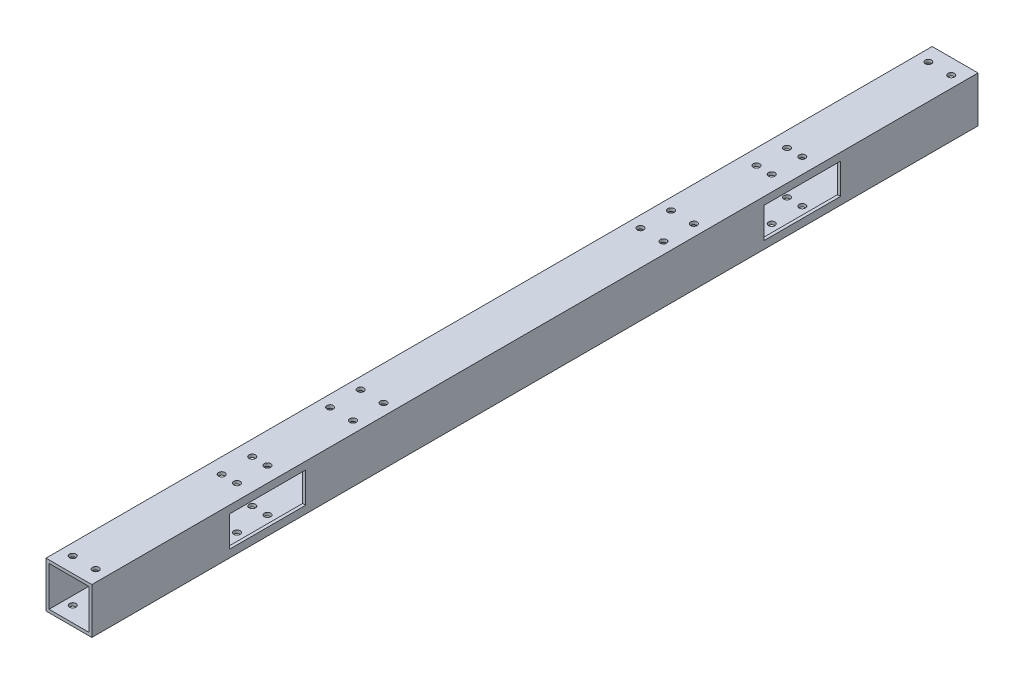
from build123d import *

# Parameters (mm, degrees)
SKETCH_1_W          = 30
SKETCH_1_H          = 30
SKETCH_1_W_2        = 26
SKETCH_1_H_2        = 26
EXTRUDE_1_DEPTH     = 580
SKETCH_2_W          = 50
SKETCH_2_H          = 20
CUT_EXTRUDE_1_DEPTH = 581.969018107
SKETCH_3_R          = 2.1
CUT_EXTRUDE_2_DEPTH = 581.969018107
SKETCH_4_R          = 2.1
CUT_EXTRUDE_3_DEPTH = 581.969018107
SKETCH_7_R          = 2.1
CUT_EXTRUDE_4_DEPTH = 581.969018107


with BuildPart() as part:
    # 草图1 → 凸台-拉伸1 (new body)
    with BuildSketch(Plane.XY):
        Rectangle(SKETCH_1_W, SKETCH_1_H)
        Rectangle(SKETCH_1_W_2, SKETCH_1_H_2, mode=Mode.SUBTRACT)
    extrude(amount=EXTRUDE_1_DEPTH)

    # 草图2 → 切除-拉伸1 (cut, through all)
    with BuildSketch(Plane.ZY.offset(15)):
        with Locations((115, 0)):
            Rectangle(SKETCH_2_W, SKETCH_2_H)
        with Locations((465, 0)):
            Rectangle(SKETCH_2_W, SKETCH_2_H)
    extrude(amount=-CUT_EXTRUDE_1_DEPTH, mode=Mode.SUBTRACT)

    # 草图3 → 切除-拉伸2 (cut, through all)
    with BuildSketch(Plane(origin=(0, 15, 0), x_dir=(1, 0, 0), z_dir=(0, 1, 0))):
        with Locations(Location((7.5, -10, 0), (0, 0, 270))):
            Circle(SKETCH_3_R)
        with Locations(Location((-7.5, -10, 0), (0, 0, 270))):
            Circle(SKETCH_3_R)
        with Locations(Location((-7.5, -570, 0), (0, 0, 270))):
            Circle(SKETCH_3_R)
        with Locations(Location((7.5, -570, 0), (0, 0, 270))):
            Circle(SKETCH_3_R)
    extrude(amount=-CUT_EXTRUDE_2_DEPTH, mode=Mode.SUBTRACT)

    # 草图4 → 切除-拉伸3 (cut, through all)
    with BuildSketch(Plane(origin=(0, 15, 0), x_dir=(1, 0, 0), z_dir=(0, 1, 0))):
        with Locations(Location((7.5, -401.567476668, 0), (0, 0, 270))):
            Circle(SKETCH_4_R)
        with Locations(Location((-7.5, -401.567476668, 0), (0, 0, 270))):
            Circle(SKETCH_4_R)
        with Locations(Location((-7.5, -381.567476668, 0), (0, 0, 270))):
            Circle(SKETCH_4_R)
        with Locations(Location((7.5, -381.567476668, 0), (0, 0, 270))):
            Circle(SKETCH_4_R)
        with Locations(Location((7.5, -178.432523332, 0), (0, 0, 270))):
            Circle(SKETCH_4_R)
        with Locations(Location((-7.5, -178.432523332, 0), (0, 0, 270))):
            Circle(SKETCH_4_R)
        with Locations(Location((-7.5, -198.432523332, 0), (0, 0, 270))):
            Circle(SKETCH_4_R)
        with Locations(Location((7.5, -198.432523332, 0), (0, 0, 270))):
            Circle(SKETCH_4_R)
        with Locations((162.5, -178.432523332)):
            Circle(SKETCH_4_R)
        with Locations((177.5, -178.432523332)):
            Circle(SKETCH_4_R)
        with Locations((177.5, -198.432523332)):
            Circle(SKETCH_4_R)
        with Locations((162.5, -198.432523332)):
            Circle(SKETCH_4_R)
        with Locations((162.5, -381.567476668)):
            Circle(SKETCH_4_R)
        with Locations((162.5, -401.567476668)):
            Circle(SKETCH_4_R)
        with Locations((177.5, -401.567476668)):
            Circle(SKETCH_4_R)
        with Locations((177.5, -381.567476668)):
            Circle(SKETCH_4_R)
    extrude(amount=-CUT_EXTRUDE_3_DEPTH, mode=Mode.SUBTRACT)

    # 草图7 → 切除-拉伸4 (cut, through all)
    with BuildSketch(Plane(origin=(0, 15, 0), x_dir=(1, 0, 0), z_dir=(0, 1, 0))):
        with Locations(Location((5, -455, 0), (0, 0, 270))):
            Circle(SKETCH_7_R)
        with Locations(Location((-5, -455, 0), (0, 0, 270))):
            Circle(SKETCH_7_R)
        with Locations(Location((-5, -475, 0), (0, 0, 270))):
            Circle(SKETCH_7_R)
        with Locations(Location((5, -475, 0), (0, 0, 270))):
            Circle(SKETCH_7_R)
    cut_extrude_4 = extrude(amount=-CUT_EXTRUDE_4_DEPTH, mode=Mode.SUBTRACT)

    # 镜向1: 切除-拉伸4 across plane
    add(cut_extrude_4.mirror(Plane(origin=(0, 0, 290), x_dir=(1, 0, 0), z_dir=(0, 0, -1))), mode=Mode.SUBTRACT)


solid = part.part
